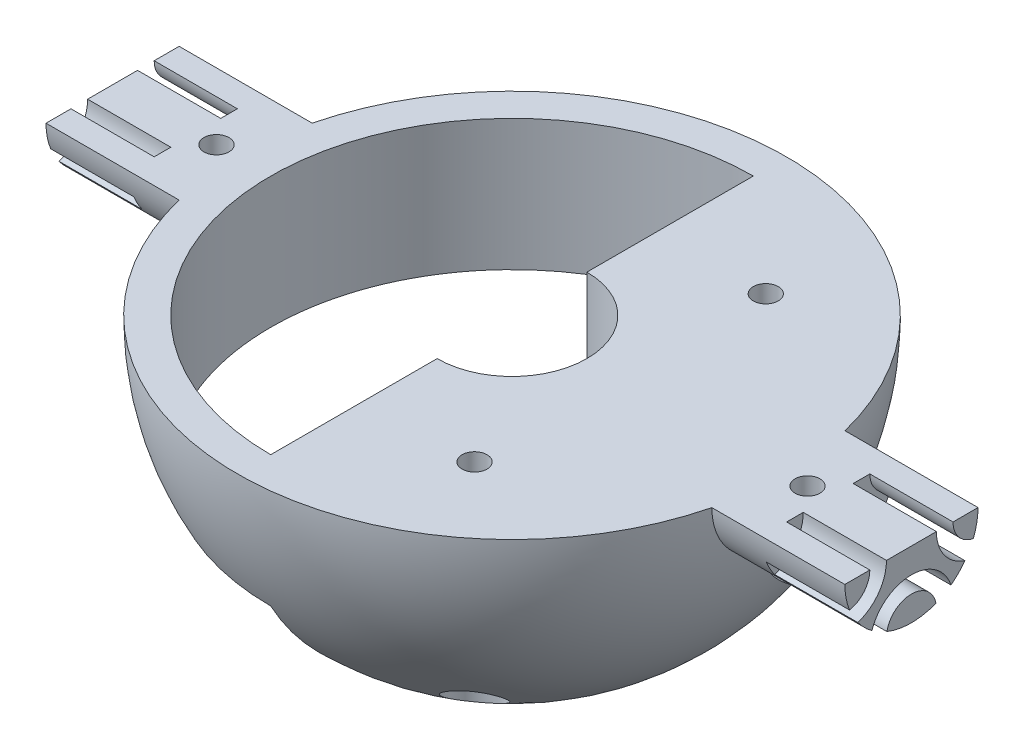
from build123d import *

# Parameters (mm, degrees)
R_VOLUTION1_ANGLE       = 90
ENL_V_MAT_EXTRU_1_DEPTH = 67.947740813
ESQUISSE3_R             = 1.5
ENL_V_MAT_EXTRU_2_DEPTH = 5
ENL_V_START             = -10
ENL_V_MAT_EXTRU_3_DEPTH = 10
ESQUISSE5_R             = 3.5
BOSS_EXTRU_1_DEPTH      = 5
ESQUISSE6_R             = 1.5
ENL_V_MAT_EXTRU_4_DEPTH = 63.904815099
ESQUISSE7_R             = 2.5
ENL_V_MAT_EXTRU_5_DEPTH = 3
ESQUISSE8_R             = 3
ENL_V_MAT_EXTRU_6_DEPTH = 61.967204407
ESQUISSE9_R             = 1.5
ENL_V_MAT_EXTRU_7_DEPTH = 61.967204407


with BuildPart() as part:
    # Esquisse1 → Révolution1 (revolve)
    with BuildSketch(Plane(origin=(0, 0, 0), x_dir=(1, 0, 0), z_dir=(0, 1, 0))):
        with BuildLine():
            ThreePointArc((-32.015621187, -8), (4.030167541, -32.752980774), (33, 0))
            Line((33, 0), (-33, 0))
            Line((-33, 0), (-48, 0))
            Line((-48, 0), (-48, -8))
            Line((-48, -8), (-32.015621187, -8))
        make_face()
        with BuildLine():
            ThreePointArc((33, 0), (32.752980774, -4.030167541), (32.015621187, -8))
            Line((32.015621187, -8), (48, -8))
            Line((48, -8), (48, 0))
            Line((48, 0), (33, 0))
        make_face()
    revolve(axis=Axis((-33, 0, 0), (1, 0, 0)), revolution_arc=R_VOLUTION1_ANGLE)

    # Esquisse2 → Enlèv. mat.-Extru.1 (cut, through all)
    with BuildSketch(Plane(origin=(0, 0, 0), x_dir=(1, 0, 0), z_dir=(0, 1, 0))):
        with BuildLine():
            Line((0, -29), (0, -9))
            ThreePointArc((0, -9), (6.363961031, -6.363961031), (9, 0))
            Line((9, 0), (-29, 0))
            ThreePointArc((-29, 0), (-20.506096654, -20.506096654), (0, -29))
        make_face()
    extrude(amount=-ENL_V_MAT_EXTRU_1_DEPTH, mode=Mode.SUBTRACT)

    # Esquisse3 → Enlèv. mat.-Extru.2 (cut)
    with BuildSketch(Plane.ZY):
        with Locations((19, -15.874507866)):
            Circle(ESQUISSE3_R)
    extrude(amount=-ENL_V_MAT_EXTRU_2_DEPTH, mode=Mode.SUBTRACT)

    # Esquisse4 → Enlèv. mat.-Extru.3 (cut)
    with BuildSketch(Plane.ZY.offset(48).offset(ENL_V_START)):
        with BuildLine():
            Line((5, 0), (3, 0))
            ThreePointArc((3, 0), (3.949537063, -2.93150985), (6.4375, -4.749588798))
            ThreePointArc((6.4375, -4.749588798), (6.995814727, -3.880538147), (7.4375, -2.946793809))
            ThreePointArc((7.4375, -2.946793809), (5.688344749, -1.912132318), (5, 0))
        make_face()
        with BuildLine():
            Line((0, -5), (0, -3))
            ThreePointArc((0, -3), (2.93150985, -3.949537063), (4.749588798, -6.4375))
            ThreePointArc((4.749588798, -6.4375), (3.880538147, -6.995814727), (2.946793809, -7.4375))
            ThreePointArc((2.946793809, -7.4375), (1.912132318, -5.688344749), (0, -5))
        make_face()
    enl_v_mat_extru_3 = extrude(amount=ENL_V_MAT_EXTRU_3_DEPTH, mode=Mode.SUBTRACT)

    # Symétrie1: Enlèv. mat.-Extru.3 across plane
    add(enl_v_mat_extru_3.mirror(Plane(origin=(0, 0, 0), x_dir=(0, 0, 1), z_dir=(1, 0, 0))), mode=Mode.SUBTRACT)

    # Symétrie2: part across face


with BuildPart() as part_1:
    add(part.part)
    add(part.part.mirror(Plane(origin=(22.19725744, -11.458481004, 0), x_dir=(1, 0, 0), z_dir=(0, 0, -1))))

    # Esquisse5 → Boss.-Extru.1 (add)
    with BuildSketch(Plane(origin=(0, -8, 0), x_dir=(-1, 0, 0), z_dir=(0, -1, 0))):
        with Locations((35.515621187, 0)):
            Circle(ESQUISSE5_R)
    boss_extru_1 = extrude(amount=-BOSS_EXTRU_1_DEPTH)

    # Esquisse6 → Enlèv. mat.-Extru.4 (cut, through all)
    with BuildSketch(Plane.XZ.offset(8)):
        with Locations(Location((-35.515621187, 0, 0), (0, 0, 270))):
            Circle(ESQUISSE6_R)
    enl_v_mat_extru_4 = extrude(amount=-ENL_V_MAT_EXTRU_4_DEPTH, mode=Mode.SUBTRACT)

    # Esquisse7 → Enlèv. mat.-Extru.5 (cut)
    with BuildSketch(Plane.XZ.offset(8)):
        with Locations(Location((-35.515621187, 0, 0), (0, 0, 270))):
            Circle(ESQUISSE7_R)
    enl_v_mat_extru_5 = extrude(amount=-ENL_V_MAT_EXTRU_5_DEPTH, mode=Mode.SUBTRACT)

    # Symétrie3: Boss.-Extru.1, Enlèv. mat.-Extru.4, Enlèv. mat.-Extru.5 across plane
    add(boss_extru_1.mirror(Plane(origin=(0, 0, 0), x_dir=(0, 0, 1), z_dir=(1, 0, 0))))
    add(enl_v_mat_extru_4.mirror(Plane(origin=(0, 0, 0), x_dir=(0, 0, 1), z_dir=(1, 0, 0))), mode=Mode.SUBTRACT)
    add(enl_v_mat_extru_5.mirror(Plane(origin=(0, 0, 0), x_dir=(0, 0, 1), z_dir=(1, 0, 0))), mode=Mode.SUBTRACT)

    # Esquisse8 → Enlèv. mat.-Extru.6 (cut, through all)
    with BuildSketch(Plane(origin=(0, -18, 0), x_dir=(1, 0, 0), z_dir=(0, 1, 0))):
        with Locations(Location((13, 17.5, 0), (0, 0, 270))):
            Circle(ESQUISSE8_R)
        with Locations(Location((13, -17.5, 0), (0, 0, 270))):
            Circle(ESQUISSE8_R)
    extrude(amount=-ENL_V_MAT_EXTRU_6_DEPTH, mode=Mode.SUBTRACT)

    # Esquisse9 → Enlèv. mat.-Extru.7 (cut, through all)
    with BuildSketch(Plane.XZ.offset(18)):
        with Locations(Location((13, -17.5, 0), (0, 0, 270))):
            Circle(ESQUISSE9_R)
        with Locations(Location((13, 17.5, 0), (0, 0, 270))):
            Circle(ESQUISSE9_R)
    extrude(amount=-ENL_V_MAT_EXTRU_7_DEPTH, mode=Mode.SUBTRACT)


solid = part_1.part
